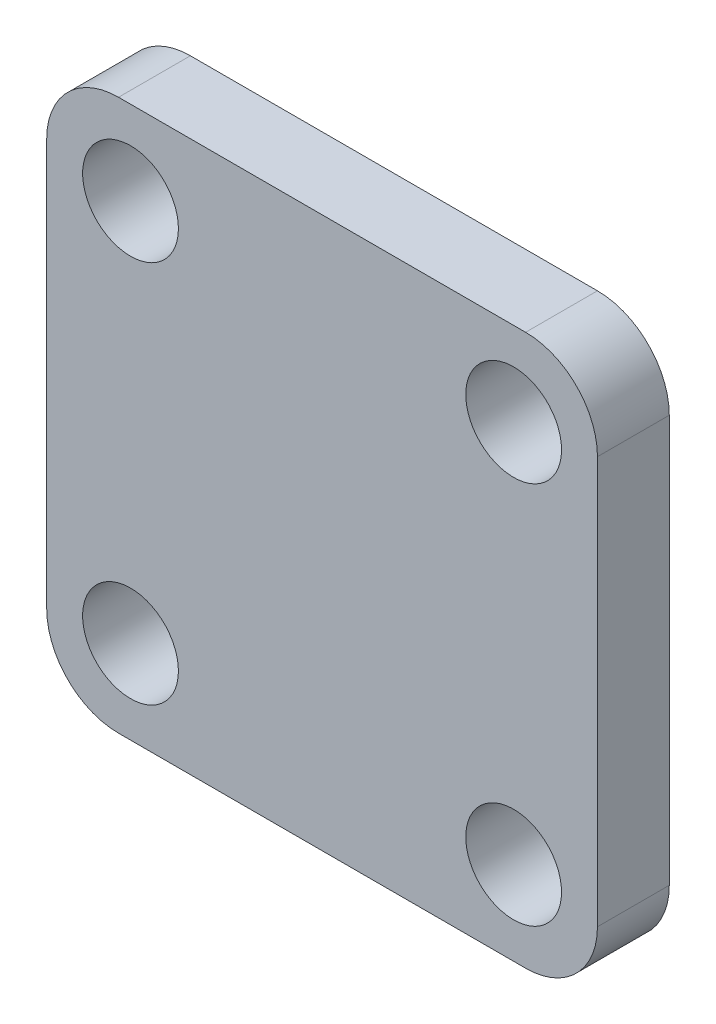
from build123d import *

# Parameters (mm, degrees)
SKETCH1_R           = 2
BOSS_EXTRUDE1_DEPTH = 3


with BuildPart() as part:
    # Sketch1 → Boss-Extrude1 (new body)
    with BuildSketch(Plane.XY):
        with BuildLine():
            Line((-8.5, 11.5), (8.5, 11.5))
            ThreePointArc((8.5, 11.5), (10.621320344, 10.621320344), (11.5, 8.5))
            Line((11.5, 8.5), (11.5, -8.5))
            ThreePointArc((11.5, -8.5), (10.621320344, -10.621320344), (8.5, -11.5))
            Line((8.5, -11.5), (-8.5, -11.5))
            ThreePointArc((-8.5, -11.5), (-10.621320344, -10.621320344), (-11.5, -8.5))
            Line((-11.5, -8.5), (-11.5, 8.5))
            ThreePointArc((-11.5, 8.5), (-10.621320344, 10.621320344), (-8.5, 11.5))
        make_face()
        with Locations((-8, 8)):
            Circle(SKETCH1_R, mode=Mode.SUBTRACT)
        with Locations((8, 8)):
            Circle(SKETCH1_R, mode=Mode.SUBTRACT)
        with Locations((8, -8)):
            Circle(SKETCH1_R, mode=Mode.SUBTRACT)
        with Locations((-8, -8)):
            Circle(SKETCH1_R, mode=Mode.SUBTRACT)
    extrude(amount=BOSS_EXTRUDE1_DEPTH)


solid = part.part
